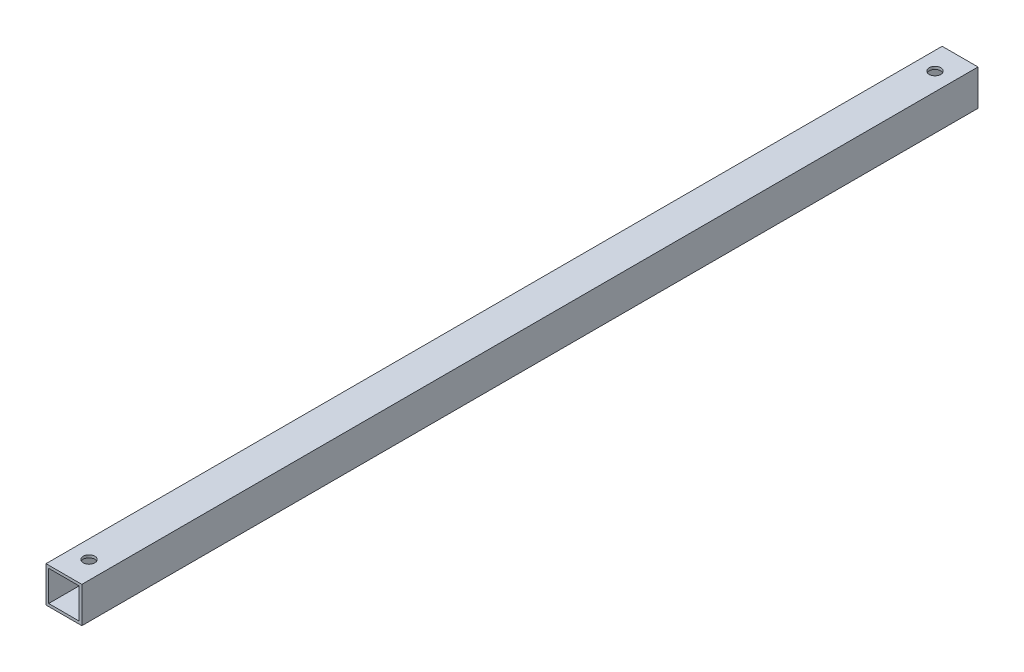
from build123d import *

# Parameters (mm, degrees)
SKIZZE1_W                       = 20
SKIZZE1_H                       = 20
SKIZZE1_W_2                     = 17
SKIZZE1_H_2                     = 17
AUFSATZ_LINEAR_AUSTRAGEN1_DEPTH = 250
SKIZZE2_R                       = 3.25
SCHNITT_LINEAR_AUSTRAGEN1_DEPTH = 15


with BuildPart() as part:
    # Skizze1 → Aufsatz-Linear austragen1 (new, symmetric)
    with BuildSketch(Plane.XY):
        Rectangle(SKIZZE1_W, SKIZZE1_H)
        Rectangle(SKIZZE1_W_2, SKIZZE1_H_2, mode=Mode.SUBTRACT)
    extrude(amount=AUFSATZ_LINEAR_AUSTRAGEN1_DEPTH, both=True)

    # Skizze2 → Schnitt-Linear austragen1 (cut, symmetric)
    with BuildSketch(Plane(origin=(0, 0, 0), x_dir=(1, 0, 0), z_dir=(0, 1, 0))):
        with Locations((0, -236)):
            Circle(SKIZZE2_R)
        with Locations((0, 236)):
            Circle(SKIZZE2_R)
    extrude(amount=SCHNITT_LINEAR_AUSTRAGEN1_DEPTH, both=True, mode=Mode.SUBTRACT)


solid = part.part
